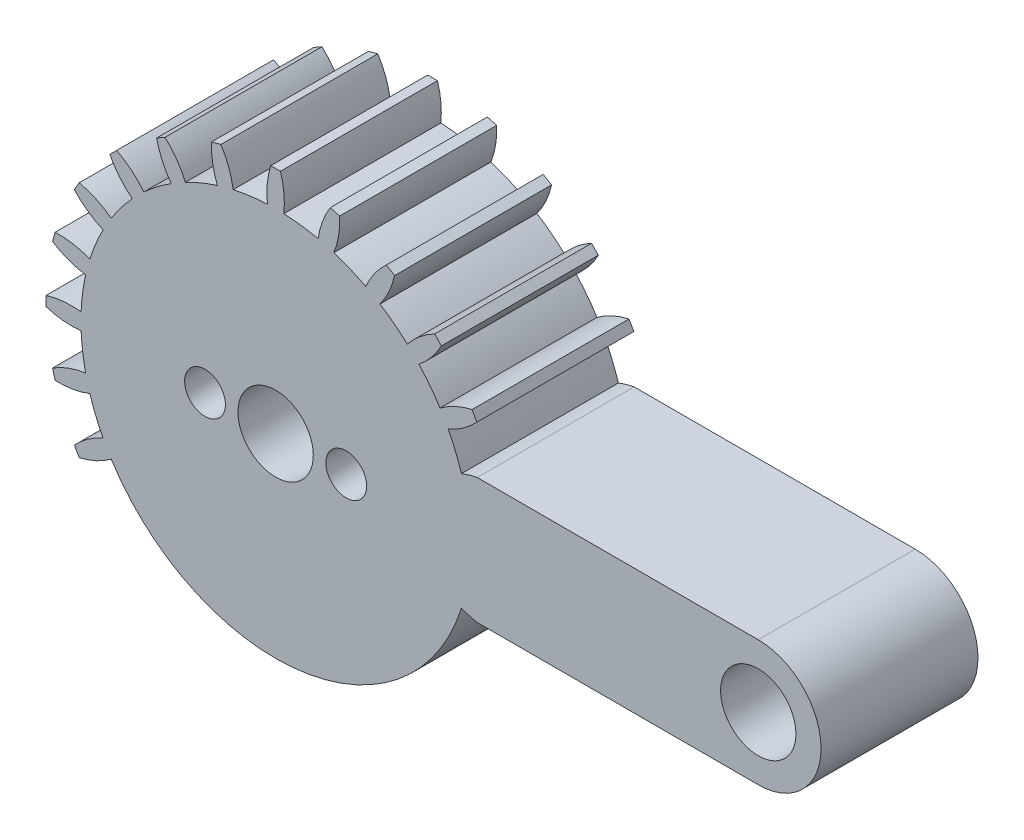
from build123d import *

# Parameters (mm, degrees)
SKETCH1_R           = 2
SKETCH1_R_2         = 2.4
BOSS_EXTRUDE1_DEPTH = 10
SKETCH2_R           = 2.4
SKETCH2_R_2         = 1.3
CUT_EXTRUDE1_DEPTH  = 40.007683858


with BuildPart() as part:
    # Sketch1 → Boss-Extrude1 (new body)
    with BuildSketch(Plane.XY):
        with BuildLine():
            Line((0.31, 14.63), (-0.31, 14.63))
            ThreePointArc((-0.31, 14.63), (-0.532517386, 13.523085628), (-0.52, 12.394096377))
            ThreePointArc((-0.52, 12.394096377), (-1.619177414, 12.298873505), (-2.70554676, 12.106363687))
            ThreePointArc((-2.70554676, 12.106363687), (-2.985659813, 13.2001233), (-3.487085624, 14.211728743))
            Line((-3.487085624, 14.211728743), (-4.085959636, 14.051260935))
            ThreePointArc((-4.085959636, 14.051260935), (-4.014404405, 12.924472018), (-3.710109619, 11.837191881))
            ThreePointArc((-3.710109619, 11.837191881), (-4.747187978, 11.460725601), (-5.746714978, 10.993602319))
            ThreePointArc((-5.746714978, 10.993602319), (-6.30036923, 11.977594384), (-7.046532125, 12.824951657))
            Line((-7.046532125, 12.824951657), (-7.583467875, 12.514951657))
            ThreePointArc((-7.583467875, 12.514951657), (-7.222716398, 11.445076999), (-6.647381398, 10.473602319))
            ThreePointArc((-6.647381398, 10.473602319), (-7.551685527, 9.841548186), (-8.396254069, 9.131645121))
            ThreePointArc((-8.396254069, 9.131645121), (-9.185718896, 9.938812205), (-10.125769107, 10.564175311))
            Line((-10.125769107, 10.564175311), (-10.564175311, 10.125769107))
            ThreePointArc((-10.564175311, 10.125769107), (-9.938812205, 9.185718896), (-9.131645121, 8.396254069))
            ThreePointArc((-9.131645121, 8.396254069), (-9.841548186, 7.551685527), (-10.473602319, 6.647381398))
            ThreePointArc((-10.473602319, 6.647381398), (-11.445076999, 7.222716398), (-12.514951657, 7.583467875))
            Line((-12.514951657, 7.583467875), (-12.824951657, 7.046532125))
            ThreePointArc((-12.824951657, 7.046532125), (-11.977594384, 6.30036923), (-10.993602319, 5.746714978))
            ThreePointArc((-10.993602319, 5.746714978), (-11.460725601, 4.747187978), (-11.837191881, 3.710109619))
            ThreePointArc((-11.837191881, 3.710109619), (-12.924472018, 4.014404405), (-14.051260935, 4.085959636))
            Line((-14.051260935, 4.085959636), (-14.211728743, 3.487085624))
            ThreePointArc((-14.211728743, 3.487085624), (-13.2001233, 2.985659813), (-12.106363687, 2.70554676))
            ThreePointArc((-12.106363687, 2.70554676), (-12.298873505, 1.619177414), (-12.394096377, 0.52))
            ThreePointArc((-12.394096377, 0.52), (-13.523085628, 0.532517386), (-14.63, 0.31))
            Line((-14.63, 0.31), (-14.63, -0.31))
            ThreePointArc((-14.63, -0.31), (-13.523085628, -0.532517386), (-12.394096377, -0.52))
            ThreePointArc((-12.394096377, -0.52), (-12.298873505, -1.619177414), (-12.106363687, -2.70554676))
            ThreePointArc((-12.106363687, -2.70554676), (-13.2001233, -2.985659813), (-14.211728743, -3.487085624))
            Line((-14.211728743, -3.487085624), (-14.051260935, -4.085959636))
            ThreePointArc((-14.051260935, -4.085959636), (-12.924472018, -4.014404405), (-11.837191881, -3.710109619))
            ThreePointArc((-11.837191881, -3.710109619), (-11.460725601, -4.747187978), (-10.993602319, -5.746714978))
            ThreePointArc((-10.993602319, -5.746714978), (-11.977594384, -6.30036923), (-12.824951657, -7.046532125))
            Line((-12.824951657, -7.046532125), (-12.514951657, -7.583467875))
            ThreePointArc((-12.514951657, -7.583467875), (-11.445076999, -7.222716398), (-10.473602319, -6.647381398))
            ThreePointArc((-10.473602319, -6.647381398), (1.619177414, -12.298873505), (11.837191881, -3.710109619))
            ThreePointArc((11.837191881, -3.710109619), (12.333238692, -3.879500788), (12.84337176, -4))
            Line((12.84337176, -4), (30.75, -4))
            ThreePointArc((30.75, -4), (34.75, 0), (30.75, 4))
            Line((30.75, 4), (12.84337176, 4))
            ThreePointArc((12.84337176, 4), (12.333238692, 3.879500788), (11.837191881, 3.710109619))
            ThreePointArc((11.837191881, 3.710109619), (11.460725601, 4.747187978), (10.993602319, 5.746714978))
            ThreePointArc((10.993602319, 5.746714978), (11.977594384, 6.30036923), (12.824951657, 7.046532125))
            Line((12.824951657, 7.046532125), (12.514951657, 7.583467875))
            ThreePointArc((12.514951657, 7.583467875), (11.445076999, 7.222716398), (10.473602319, 6.647381398))
            ThreePointArc((10.473602319, 6.647381398), (9.841548186, 7.551685527), (9.131645121, 8.396254069))
            ThreePointArc((9.131645121, 8.396254069), (9.938812205, 9.185718896), (10.564175311, 10.125769107))
            Line((10.564175311, 10.125769107), (10.125769107, 10.564175311))
            ThreePointArc((10.125769107, 10.564175311), (9.185718896, 9.938812205), (8.396254069, 9.131645121))
            ThreePointArc((8.396254069, 9.131645121), (7.551685527, 9.841548186), (6.647381398, 10.473602319))
            ThreePointArc((6.647381398, 10.473602319), (7.222716398, 11.445076999), (7.583467875, 12.514951657))
            Line((7.583467875, 12.514951657), (7.046532125, 12.824951657))
            ThreePointArc((7.046532125, 12.824951657), (6.30036923, 11.977594384), (5.746714978, 10.993602319))
            ThreePointArc((5.746714978, 10.993602319), (4.747187978, 11.460725601), (3.710109619, 11.837191881))
            ThreePointArc((3.710109619, 11.837191881), (4.014404405, 12.924472018), (4.085959636, 14.051260935))
            Line((4.085959636, 14.051260935), (3.487085624, 14.211728743))
            ThreePointArc((3.487085624, 14.211728743), (2.985659813, 13.2001233), (2.70554676, 12.106363687))
            ThreePointArc((2.70554676, 12.106363687), (1.619177414, 12.298873505), (0.52, 12.394096377))
            ThreePointArc((0.52, 12.394096377), (0.532517386, 13.523085628), (0.31, 14.63))
        make_face()
        Circle(SKETCH1_R, mode=Mode.SUBTRACT)
        with Locations((30.75, 0)):
            Circle(SKETCH1_R_2, mode=Mode.SUBTRACT)
    extrude(amount=BOSS_EXTRUDE1_DEPTH)

    # Sketch2 → Cut-Extrude1 (cut, through all)
    with BuildSketch(Plane.XY.offset(10)):
        Circle(SKETCH2_R)
        with Locations((4.5, 0)):
            Circle(SKETCH2_R_2)
        with Locations((-4.5, 0)):
            Circle(SKETCH2_R_2)
    extrude(amount=-CUT_EXTRUDE1_DEPTH, mode=Mode.SUBTRACT)


solid = part.part
